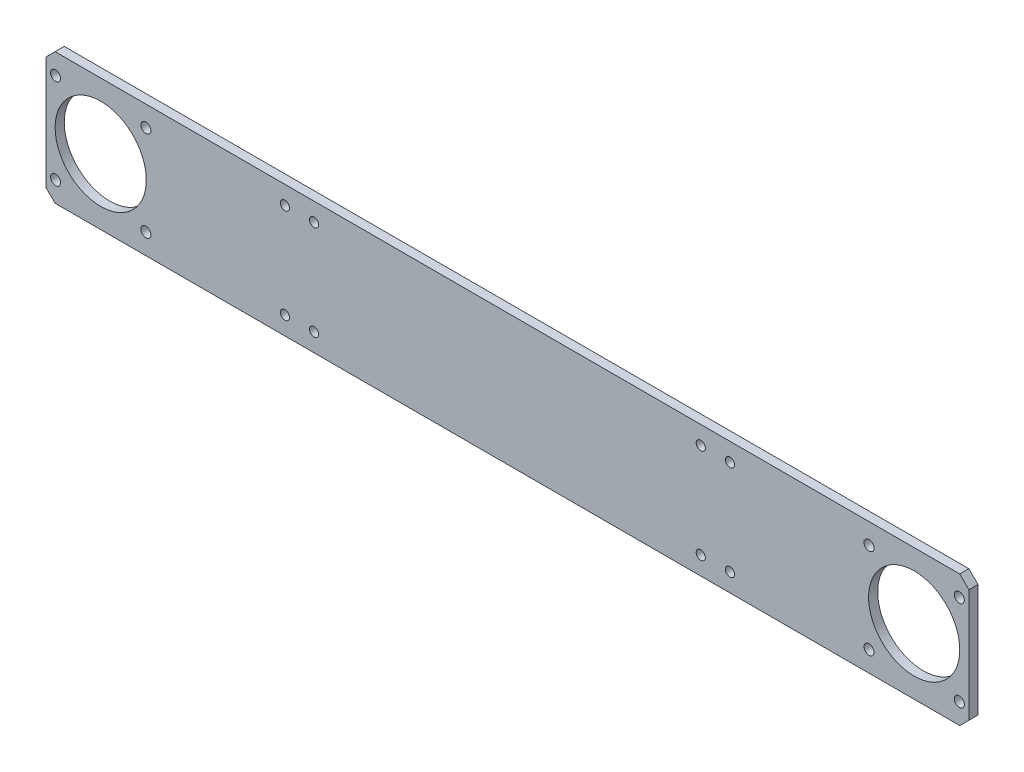
from build123d import *

# Parameters (mm, degrees)
SKETCH_1_W          = 506
SKETCH_1_H          = 72
SKETCH_1_R          = 25
SKETCH_1_R_2        = 2.75
EXTRUDE_1_DEPTH     = 5
CHAMFER_1_SIZE      = 5
SKETCH_2_R          = 2.5
CUT_EXTRUDE_1_DEPTH = 256.597339579


with BuildPart() as part:
    # 草图1 → 凸台-拉伸1 (new body)
    with BuildSketch(Plane.XY):
        Rectangle(SKETCH_1_W, SKETCH_1_H)
        with Locations((223, 0)):
            Circle(SKETCH_1_R, mode=Mode.SUBTRACT)
        with Locations((247.748737342, 24.748737342)):
            Circle(SKETCH_1_R_2, mode=Mode.SUBTRACT)
        with Locations((198.251262658, 24.748737342)):
            Circle(SKETCH_1_R_2, mode=Mode.SUBTRACT)
        with Locations((198.251262658, -24.748737342)):
            Circle(SKETCH_1_R_2, mode=Mode.SUBTRACT)
        with Locations((247.748737342, -24.748737342)):
            Circle(SKETCH_1_R_2, mode=Mode.SUBTRACT)
        with Locations(Location((-247.748737342, -24.748737342, 0), (0, 0, 180))):
            Circle(SKETCH_1_R_2, mode=Mode.SUBTRACT)
        with Locations(Location((-247.748737342, 24.748737342, 0), (0, 0, 180))):
            Circle(SKETCH_1_R_2, mode=Mode.SUBTRACT)
        with Locations(Location((-198.251262658, 24.748737342, 0), (0, 0, 180))):
            Circle(SKETCH_1_R_2, mode=Mode.SUBTRACT)
        with Locations(Location((-198.251262658, -24.748737342, 0), (0, 0, 180))):
            Circle(SKETCH_1_R_2, mode=Mode.SUBTRACT)
        with Locations(Location((-223, 0, 0), (0, 0, 180))):
            Circle(SKETCH_1_R, mode=Mode.SUBTRACT)
    extrude(amount=EXTRUDE_1_DEPTH)

    # 倒角1
    chamfer_1_edges = [part.edges().sort_by_distance(p)[0] for p in [
        (-253, 36, 2.5),
        (253, 36, 2.5),
        (253, -36, 2.5),
        (-253, -36, 2.5),
    ]]
    chamfer(chamfer_1_edges, length=CHAMFER_1_SIZE)

    # 草图2 → 切除-拉伸1 (cut, through all)
    with BuildSketch(Plane.XY.offset(5)):
        with Locations((-122, 26)):
            Circle(SKETCH_2_R)
        with Locations((-122, -26)):
            Circle(SKETCH_2_R)
        with Locations((-106, 26)):
            Circle(SKETCH_2_R)
        with Locations((-106, -26)):
            Circle(SKETCH_2_R)
        with Locations(Location((106, -26, 0), (0, 0, 180))):
            Circle(SKETCH_2_R)
        with Locations(Location((106, 26, 0), (0, 0, 180))):
            Circle(SKETCH_2_R)
        with Locations(Location((122, -26, 0), (0, 0, 180))):
            Circle(SKETCH_2_R)
        with Locations(Location((122, 26, 0), (0, 0, 180))):
            Circle(SKETCH_2_R)
    extrude(amount=-CUT_EXTRUDE_1_DEPTH, mode=Mode.SUBTRACT)


solid = part.part
